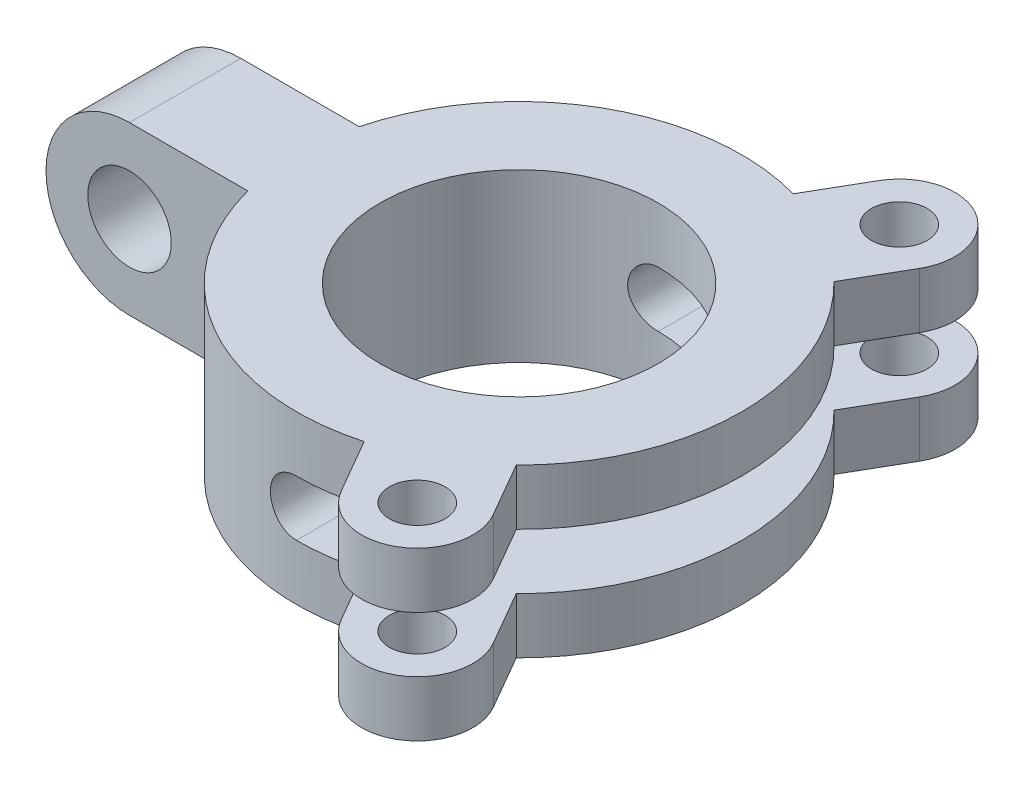
from build123d import *

# Parameters (mm, degrees)
SKETCH1_R               = 40
SKETCH1_R_2             = 25
BOSS_EXTRUDE1_DEPTH     = 15
CUT_EXTRUDE1_DEPTH      = 59.523499554
CUT_EXTRUDE1_DEPTH_BACK = 59.523499554
SKETCH2_R               = 5
SKETCH2_W               = 40
SKETCH2_H               = 10
BOSS_EXTRUDE2_START     = 15
SKETCH3_R               = 5
BOSS_EXTRUDE2_DEPTH     = 10
MIRROR2_START           = 15
MIRROR2_COPY_1_SKETCH_R = 5
MIRROR2_COPY_1_DEPTH    = 10
BOSS_EXTRUDE4_DEPTH     = 10


with BuildPart() as part:
    # Sketch1 → Boss-Extrude1 (new, symmetric)
    with BuildSketch(Plane(origin=(0, 0, 0), x_dir=(1, 0, 0), z_dir=(0, 1, 0))):
        with Locations(Location((0, 0, 0), (0, 0, 270))):
            Circle(SKETCH1_R)
        with Locations(Location((0, 0, 0), (0, 0, 270))):
            Circle(SKETCH1_R_2, mode=Mode.SUBTRACT)
    extrude(amount=BOSS_EXTRUDE1_DEPTH, both=True)

    # Sketch2 → Cut-Extrude1 (cut, two sides: drawn at the far end of the back side and taken through both)
    with BuildSketch(Plane.XY.offset(-CUT_EXTRUDE1_DEPTH_BACK)):
        Circle(SKETCH2_R)
        with Locations((20, 0)):
            Rectangle(SKETCH2_W, SKETCH2_H)
    extrude(amount=CUT_EXTRUDE1_DEPTH + CUT_EXTRUDE1_DEPTH_BACK, mode=Mode.SUBTRACT)

    # Sketch3 → Boss-Extrude2 (add)
    with BuildSketch(Plane(origin=(0, 0, 0), x_dir=(1, 0, 0), z_dir=(0, 1, 0)).offset(BOSS_EXTRUDE2_START)):
        with BuildLine():
            Line((16.339745962, -48.301270189), (10.704662693, -38.541019662))
            ThreePointArc((10.704662693, -38.541019662), (20, -34.641016151), (28.025170769, -28.541019662))
            Line((28.025170769, -28.541019662), (33.660254038, -38.301270189))
            ThreePointArc((33.660254038, -38.301270189), (30, -51.961524227), (16.339745962, -48.301270189))
        make_face()
        with Locations(Location((25, -43.301270189, 0), (0, 0, 270))):
            Circle(SKETCH3_R, mode=Mode.SUBTRACT)
    boss_extrude2 = extrude(amount=-BOSS_EXTRUDE2_DEPTH)

    # Mirror1: Boss-Extrude2 across plane
    add(boss_extrude2.mirror(Plane.XY))

    # Mirror2: Boss-Extrude2 across plane
    add(boss_extrude2.mirror(Plane.ZX))

    # Mirror2 copy 1 sketch → Mirror2 copy 1 (add)
    with BuildSketch(Plane.XZ.offset(MIRROR2_START)):
        with BuildLine():
            Line((16.339745962, -48.301270189), (10.704662693, -38.541019662))
            ThreePointArc((10.704662693, -38.541019662), (20, -34.641016151), (28.025170769, -28.541019662))
            Line((28.025170769, -28.541019662), (33.660254038, -38.301270189))
            ThreePointArc((33.660254038, -38.301270189), (30, -51.961524227), (16.339745962, -48.301270189))
        make_face()
        with Locations(Location((25, -43.301270189, 0), (0, 0, 270))):
            Circle(MIRROR2_COPY_1_SKETCH_R, mode=Mode.SUBTRACT)
    extrude(amount=-MIRROR2_COPY_1_DEPTH)

    # Sketch4 → Boss-Extrude4 (add, symmetric)
    with BuildSketch(Plane.XY):
        with BuildLine():
            ThreePointArc((-60, -15), (-49.393398282, -10.606601718), (-45, 0))
            Line((-45, 0), (-52.5, 0))
            ThreePointArc((-52.5, 0), (-60, -7.5), (-67.5, 0))
            Line((-67.5, 0), (-75, 0))
            ThreePointArc((-75, 0), (-70.606601718, -10.606601718), (-60, -15))
        make_face()
        with BuildLine():
            Line((-52.5, 0), (-45, 0))
            ThreePointArc((-45, 0), (-49.393398282, 10.606601718), (-60, 15))
            ThreePointArc((-60, 15), (-70.606601718, 10.606601718), (-75, 0))
            Line((-75, 0), (-67.5, 0))
            ThreePointArc((-67.5, 0), (-60, 7.5), (-52.5, 0))
        make_face()
        with BuildLine():
            ThreePointArc((-60, 15), (-49.393398282, 10.606601718), (-45, 0))
            Line((-45, 0), (-25, 0))
            Line((-25, 0), (-25, 15))
            Line((-25, 15), (-60, 15))
        make_face()
        with BuildLine():
            Line((-25, 0), (-45, 0))
            ThreePointArc((-45, 0), (-49.393398282, -10.606601718), (-60, -15))
            Line((-60, -15), (-25, -15))
            Line((-25, -15), (-25, 0))
        make_face()
    extrude(amount=BOSS_EXTRUDE4_DEPTH, both=True)


solid = part.part
